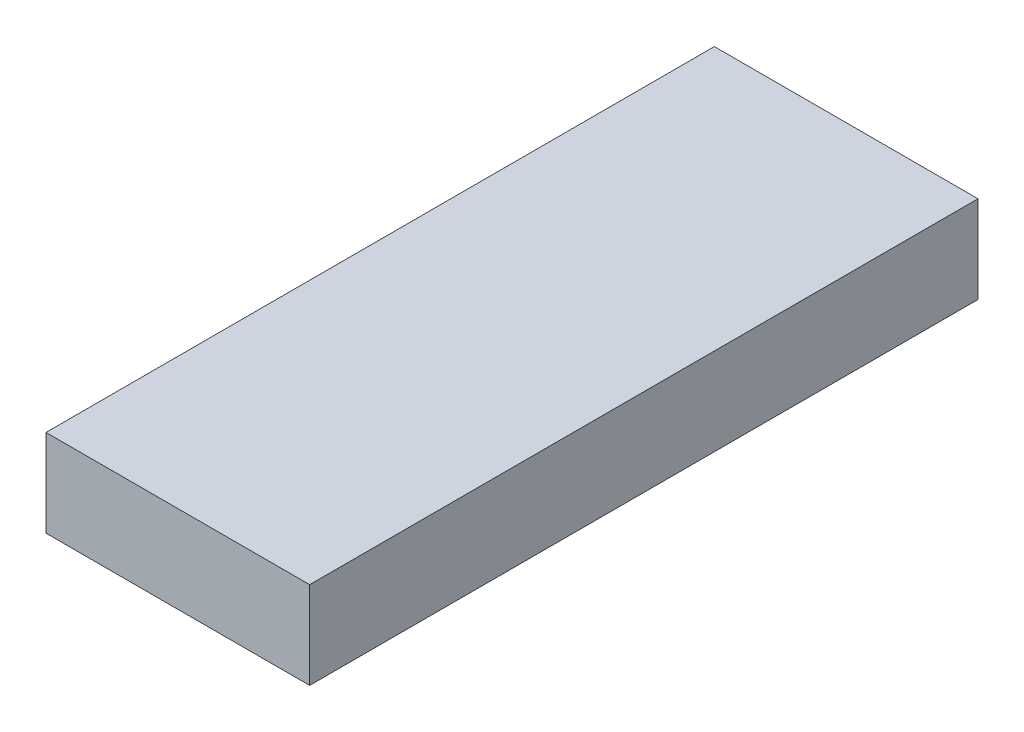
from build123d import *

# Parameters (mm, degrees)
SKETCH1_W           = 18.034
SKETCH1_H           = 45.72
BOSS_EXTRUDE1_DEPTH = 5.969


with BuildPart() as part:
    # Sketch1 → Boss-Extrude1 (new body)
    with BuildSketch(Plane(origin=(0, 0, 0), x_dir=(1, 0, 0), z_dir=(0, 1, 0))):
        Rectangle(SKETCH1_W, SKETCH1_H)
    extrude(amount=BOSS_EXTRUDE1_DEPTH)


solid = part.part
